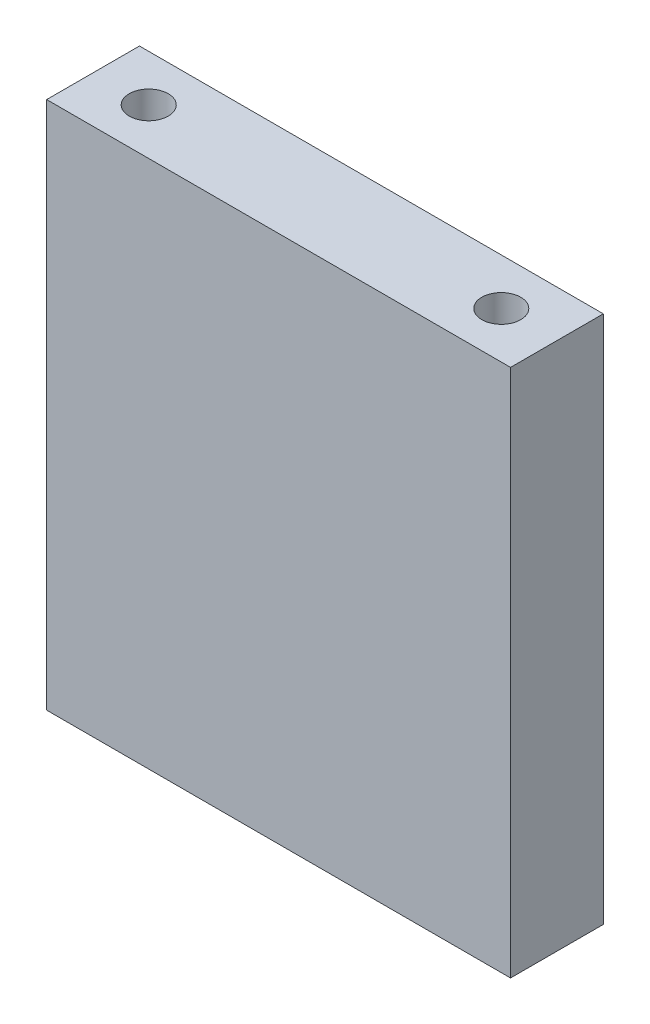
from build123d import *

# Parameters (mm, degrees)
ESBO_O1_W                                   = 50
ESBO_O1_H                                   = 57
ESBO_O1_R                                   = 13
RESSALTO_EXTRUS_O1_DEPTH                    = 8
ESBO_O3_W                                   = 50
ESBO_O3_H                                   = 57
RESSALTO_EXTRUS_O2_DEPTH                    = 2
BROCA_DE_ROSQUEAR_PARA_TARRAXA_DE_M51_D     = 4.2
BROCA_DE_ROSQUEAR_PARA_TARRAXA_DE_M51_DEPTH = 15
BROCA_DE_ROSQUEAR_PARA_TARRAXA_DE_M51_TIP   = 1.2618073
BROCA_DE_ROSQUEAR_PARA_TARRAXA_DE_M52_D     = 4.2
BROCA_DE_ROSQUEAR_PARA_TARRAXA_DE_M52_DEPTH = 15
BROCA_DE_ROSQUEAR_PARA_TARRAXA_DE_M52_TIP   = 1.2618073


with BuildPart() as part:
    # Esboço1 → Ressalto-extrusão1 (new body)
    with BuildSketch(Plane.XY):
        with Locations((25, 28.5)):
            Rectangle(ESBO_O1_W, ESBO_O1_H)
        with Locations((25, 25)):
            Circle(ESBO_O1_R, mode=Mode.SUBTRACT)
    extrude(amount=RESSALTO_EXTRUS_O1_DEPTH)

    # Esboço3 → Ressalto-extrusão2 (add)
    with BuildSketch(Plane.XY.offset(8)):
        with Locations((25, 28.5)):
            Rectangle(ESBO_O3_W, ESBO_O3_H)
    extrude(amount=RESSALTO_EXTRUS_O2_DEPTH)

    # Broca de rosquear para tarraxa de M51
    with Locations(Plane(origin=(0, 0, 0), x_dir=(-1, 0, 0), z_dir=(0, -1, 0))):
        with Locations((-6, -5), (-44, -5)):
            Hole(BROCA_DE_ROSQUEAR_PARA_TARRAXA_DE_M51_D / 2, depth=BROCA_DE_ROSQUEAR_PARA_TARRAXA_DE_M51_DEPTH)
            with Locations((0, 0, -(BROCA_DE_ROSQUEAR_PARA_TARRAXA_DE_M51_DEPTH + BROCA_DE_ROSQUEAR_PARA_TARRAXA_DE_M51_TIP / 2))):  # 118° drill point
                Cone(0, BROCA_DE_ROSQUEAR_PARA_TARRAXA_DE_M51_D / 2, BROCA_DE_ROSQUEAR_PARA_TARRAXA_DE_M51_TIP, mode=Mode.SUBTRACT)

    # Broca de rosquear para tarraxa de M52
    with Locations(Plane(origin=(0, 57, 0), x_dir=(1, 0, 0), z_dir=(0, 1, 0))):
        with Locations((6, -5), (44, -5)):
            Hole(BROCA_DE_ROSQUEAR_PARA_TARRAXA_DE_M52_D / 2, depth=BROCA_DE_ROSQUEAR_PARA_TARRAXA_DE_M52_DEPTH)
            with Locations((0, 0, -(BROCA_DE_ROSQUEAR_PARA_TARRAXA_DE_M52_DEPTH + BROCA_DE_ROSQUEAR_PARA_TARRAXA_DE_M52_TIP / 2))):  # 118° drill point
                Cone(0, BROCA_DE_ROSQUEAR_PARA_TARRAXA_DE_M52_D / 2, BROCA_DE_ROSQUEAR_PARA_TARRAXA_DE_M52_TIP, mode=Mode.SUBTRACT)


solid = part.part
